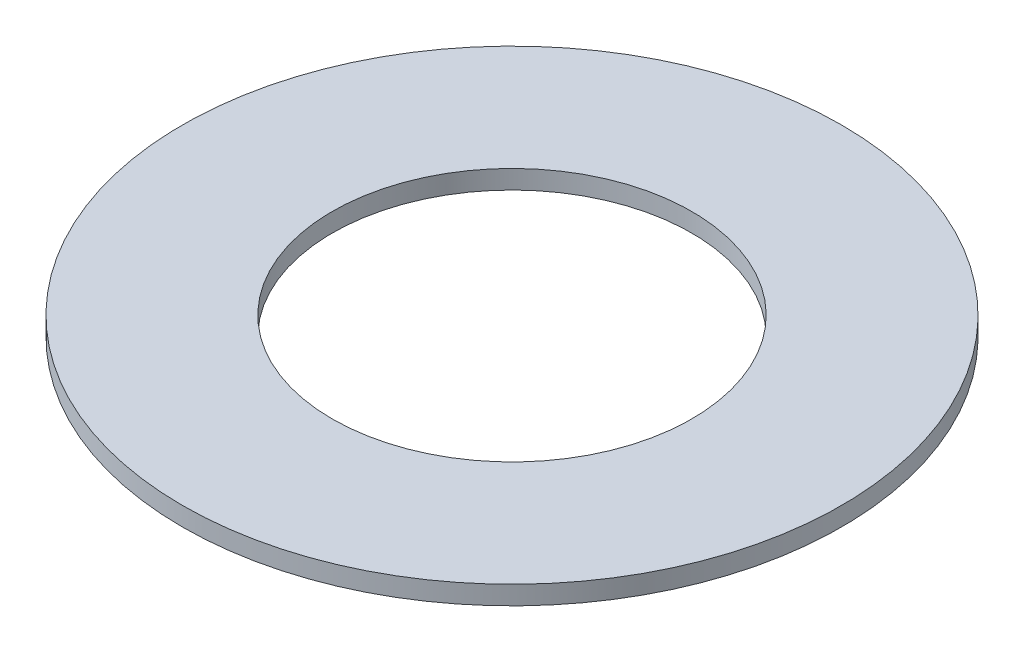
from build123d import *

# Parameters (mm, degrees)
SKETCH2_R           = 110
BOSS_EXTRUDE1_DEPTH = 6.25
SKETCH3_R           = 60
CUT_EXTRUDE1_DEPTH  = 6.25


with BuildPart() as part:
    # Sketch2 → Boss-Extrude1 (new body)
    with BuildSketch(Plane(origin=(0, 0, 0), x_dir=(1, 0, 0), z_dir=(0, 1, 0))):
        with Locations(Location((0, 0, 0), (0, 0, 270))):
            Circle(SKETCH2_R)
    extrude(amount=BOSS_EXTRUDE1_DEPTH)

    # Sketch3 → Cut-Extrude1 (cut)
    with BuildSketch(Plane(origin=(0, 6.25, 0), x_dir=(1, 0, 0), z_dir=(0, 1, 0))):
        with Locations(Location((0, 0, 0), (0, 0, 270))):
            Circle(SKETCH3_R)
    extrude(amount=-CUT_EXTRUDE1_DEPTH, mode=Mode.SUBTRACT)


solid = part.part
